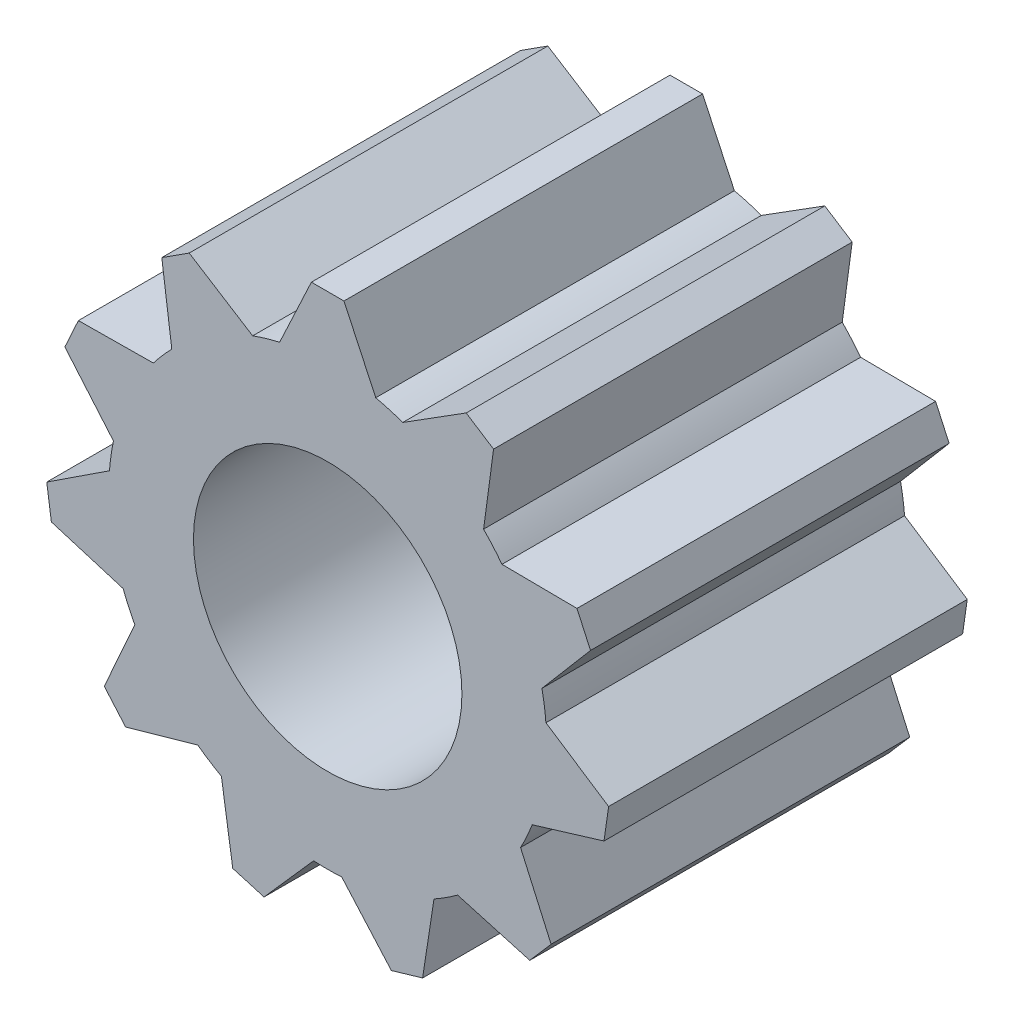
from build123d import *

# Parameters (mm, degrees)
SKETCH1_R           = 26.948722821
BOSS_EXTRUDE2_DEPTH = 72


with BuildPart() as part:
    # Sketch1 → Boss-Extrude2 (new body)
    with BuildSketch(Plane.XY):
        with BuildLine():
            Line((-9.649968123, 42.875568313), (-3.270074231, 56.514068549))
            Line((-3.270074231, 56.514068549), (3.270074231, 56.514068549))
            Line((3.270074231, 56.514068549), (9.649968123, 42.875568313))
            ThreePointArc((9.649968123, 42.875568313), (12.381612983, 42.167901333), (15.062212526, 41.28638997))
            Line((15.062212526, 41.28638997), (27.802850719, 49.310595427))
            Line((27.802850719, 49.310595427), (33.304773717, 45.774724216))
            Line((33.304773717, 45.774724216), (31.298352077, 30.852056661))
            ThreePointArc((31.298352077, 30.852056661), (33.213764311, 28.779890604), (34.992247123, 26.589074527))
            Line((34.992247123, 26.589074527), (50.048567011, 26.451356669))
            Line((50.048567011, 26.451356669), (52.765442869, 20.502228373))
            Line((52.765442869, 20.502228373), (43.00973039, 9.033235009))
            ThreePointArc((43.00973039, 9.033235009), (43.500780148, 6.254467957), (43.812490502, 3.449915791))
            Line((43.812490502, 3.449915791), (56.404216903, -4.806000935))
            Line((56.404216903, -4.806000935), (55.473456732, -11.279580116))
            Line((55.473456732, -11.279580116), (41.065823196, -15.653574932))
            ThreePointArc((41.065823196, -15.653574932), (39.97660565, -18.256704074), (38.72257771, -20.784566832))
            Line((38.72257771, -20.784566832), (44.851926462, -34.5374872))
            Line((44.851926462, -34.5374872), (40.56904004, -39.480201616))
            Line((40.56904004, -39.480201616), (26.083807295, -35.370485435))
            ThreePointArc((26.083807295, -35.370485435), (23.760141319, -36.971501558), (21.338520096, -38.420096343))
            Line((21.338520096, -38.420096343), (19.059466278, -53.303565309))
            Line((19.059466278, -53.303565309), (12.784239782, -55.146138057))
            Line((12.784239782, -55.146138057), (2.820366877, -43.857516729))
            ThreePointArc((2.820366877, -43.857516729), (0, -43.948108525), (-2.820366877, -43.857516729))
            Line((-2.820366877, -43.857516729), (-12.784239782, -55.146138057))
            Line((-12.784239782, -55.146138057), (-19.059466278, -53.303565309))
            Line((-19.059466278, -53.303565309), (-21.338520096, -38.420096343))
            ThreePointArc((-21.338520096, -38.420096343), (-23.760141319, -36.971501558), (-26.083807295, -35.370485435))
            Line((-26.083807295, -35.370485435), (-40.56904004, -39.480201616))
            Line((-40.56904004, -39.480201616), (-44.851926462, -34.5374872))
            Line((-44.851926462, -34.5374872), (-38.72257771, -20.784566832))
            ThreePointArc((-38.72257771, -20.784566832), (-39.97660565, -18.256704074), (-41.065823196, -15.653574932))
            Line((-41.065823196, -15.653574932), (-55.473456732, -11.279580116))
            Line((-55.473456732, -11.279580116), (-56.404216903, -4.806000935))
            Line((-56.404216903, -4.806000935), (-43.812490502, 3.449915791))
            ThreePointArc((-43.812490502, 3.449915791), (-43.500780148, 6.254467957), (-43.00973039, 9.033235009))
            Line((-43.00973039, 9.033235009), (-52.765442869, 20.502228373))
            Line((-52.765442869, 20.502228373), (-50.048567011, 26.451356669))
            Line((-50.048567011, 26.451356669), (-34.992247123, 26.589074527))
            ThreePointArc((-34.992247123, 26.589074527), (-33.213764311, 28.779890604), (-31.298352077, 30.852056661))
            Line((-31.298352077, 30.852056661), (-33.304773718, 45.774724216))
            Line((-33.304773718, 45.774724216), (-27.802850719, 49.310595427))
            Line((-27.802850719, 49.310595427), (-15.062212526, 41.28638997))
            ThreePointArc((-15.062212526, 41.28638997), (-12.381612983, 42.167901333), (-9.649968123, 42.875568313))
        make_face()
        Circle(SKETCH1_R, mode=Mode.SUBTRACT)
    extrude(amount=BOSS_EXTRUDE2_DEPTH)


solid = part.part
